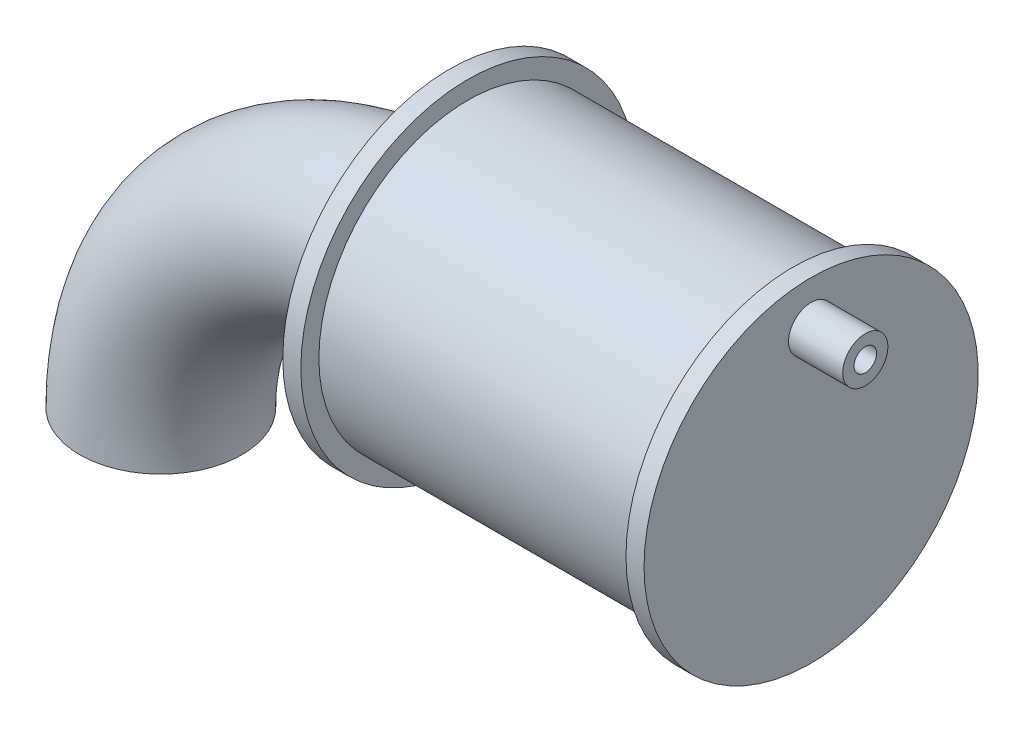
from build123d import *

# Parameters (mm, degrees)
ESQUISSE2_R             = 2.5
BOSS_EXTRU_1_DEPTH      = 6
ESQUISSE3_R             = 1.25
ENL_V_MAT_EXTRU_1_DEPTH = 14.3
ESQUISSE4_R             = 9
ENL_V_MAT_EXTRU_2_DEPTH = 5
ESQUISSE6_R             = 9
ESQUISSE6_R_2           = 7


with BuildPart() as part:
    # Esquisse1 → Base-Révolution (revolve)
    with BuildSketch(Plane.XY, mode=Mode.PRIVATE) as base_r_volution_sk:
        Polygon((2, 16.5), (38, 16.5), (38, 18.5), (40, 18.5), (40, 0), (38, 0), (38, 15.5), (2, 15.5), (2, 0), (0, 0), (0, 18.5), (2, 18.5), align=None)
    revolve(base_r_volution_sk.sketch.rotate(Axis((-25.081544634, 0, 0), (1, 0, 0)), 90), axis=Axis((-25.081544634, 0, 0), (1, 0, 0)))

    # Esquisse2 → Boss.-Extru.1 (add)
    with BuildSketch(Plane(origin=(40, 0, 0), x_dir=(0, 0, -1), z_dir=(1, 0, 0))):
        with Locations(Location((0, 13.61181584, 0), (0, 0, 180))):
            Circle(ESQUISSE2_R)
    extrude(amount=BOSS_EXTRU_1_DEPTH)

    # Esquisse3 → Enlèv. mat.-Extru.1 (cut)
    with BuildSketch(Plane(origin=(46, 0, 0), x_dir=(0, 0, -1), z_dir=(1, 0, 0))):
        with Locations((0, 13.61181584)):
            Circle(ESQUISSE3_R)
    extrude(amount=-ENL_V_MAT_EXTRU_1_DEPTH, mode=Mode.SUBTRACT)

    # Esquisse4 → Enlèv. mat.-Extru.2 (cut)
    with BuildSketch(Plane.ZY):
        Circle(ESQUISSE4_R)
    extrude(amount=-ENL_V_MAT_EXTRU_2_DEPTH, mode=Mode.SUBTRACT)

    # Boss.-Balayage1: sweep along a path in Esquisse7
    with BuildLine(Plane.XY) as boss_balayage1_path:
        Line((2, 0), (-2, 0))
        ThreePointArc((-2, 0), (-23.213203436, -8.786796564), (-32, -30))
    # Esquisse6 → Boss.-Balayage1 (sweep)
    with BuildSketch(Plane(origin=(2, 0, 0), x_dir=(0, 0, -1), z_dir=(1, 0, 0))):
        Circle(ESQUISSE6_R)
        Circle(ESQUISSE6_R_2, mode=Mode.SUBTRACT)
    sweep(path=boss_balayage1_path.line)


solid = part.part
